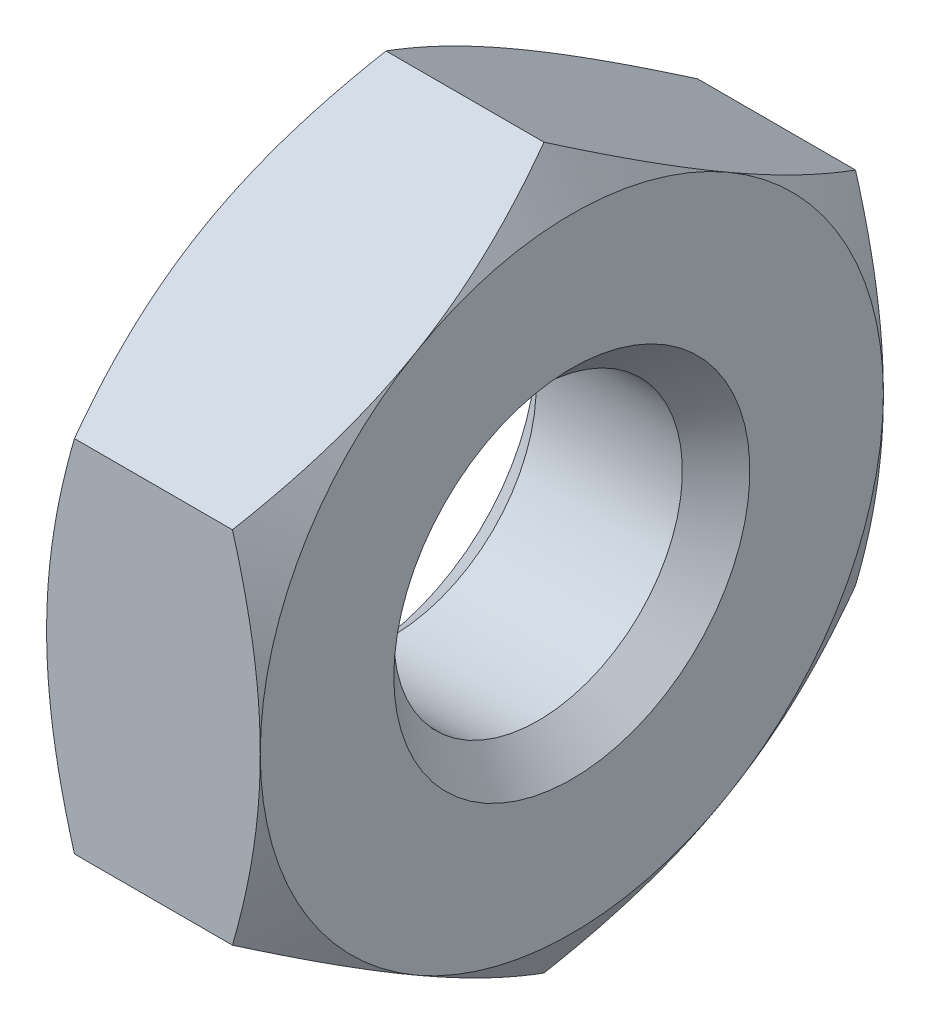
from build123d import *

# Parameters (mm, degrees)
CUT_EXTRUDE_1_DEPTH      = 2.4
CUT_EXTRUDE_1_DEPTH_BACK = 2.4
SKETCH_2_W               = 16.2
SKETCH_2_H               = 16.2


with BuildPart() as part:
    # 草图1 → 旋转1 (revolve)
    with BuildSketch(Plane.XY):
        Polygon((-1.2, 0), (-1.2, 3.5), (-0.795854812, 4.2), (0.795854812, 4.2), (1.2, 3.5), (1.2, 0), align=None)
    revolve(axis=Axis((1.2, 0, 0), (-1, 0, 0)))

    # 草图2 → 切除-拉伸1 (cut, two sides: drawn at the far end of the back side and taken through both)
    with BuildSketch(Plane(origin=(0, 0, 0), x_dir=(0, 0, -1), z_dir=(1, 0, 0)).offset(-CUT_EXTRUDE_1_DEPTH_BACK)):
        Rectangle(SKETCH_2_W, SKETCH_2_H)
        Polygon((-3.5, 2.020725942), (-3.5, -2.020725942), (0, -4.041451884), (3.5, -2.020725942), (3.5, 2.020725942), (0, 4.041451884), align=None, mode=Mode.SUBTRACT)
    extrude(amount=CUT_EXTRUDE_1_DEPTH + CUT_EXTRUDE_1_DEPTH_BACK, mode=Mode.SUBTRACT)

    # 草图3 → 切除-旋转1 (revolve, cut)
    with BuildSketch(Plane.XY):
        Polygon((-1.2, 0), (-1.2, 2), (-0.821, 1.621), (0.821, 1.621), (1.2, 2), (1.2, 0), align=None)
    revolve(axis=Axis((1.2, 0, 0), (-1, 0, 0)), mode=Mode.SUBTRACT)


solid = part.part
